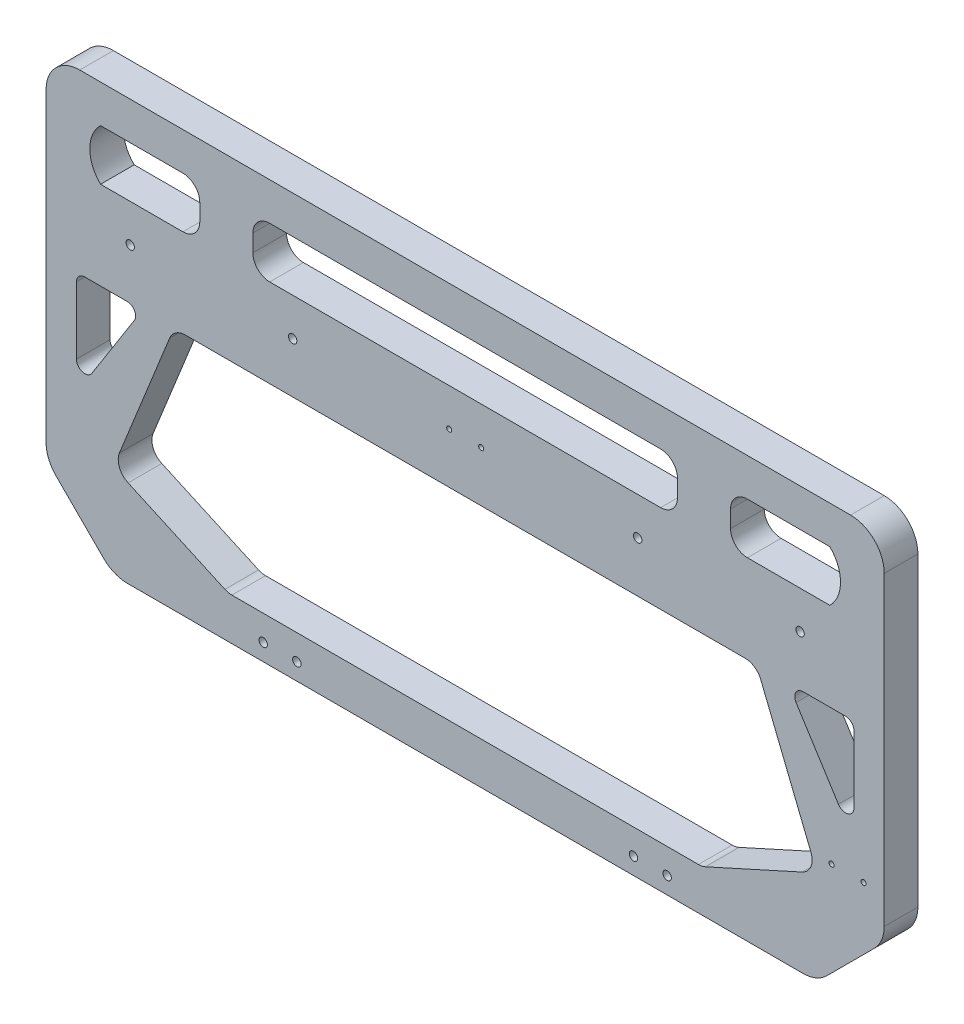
from build123d import *

# Parameters (mm, degrees)
SKETCH1_R           = 2.5
SKETCH1_R_2         = 1.5
BOSS_EXTRUDE1_DEPTH = 20
SKETCH3_R           = 2.5
CUT_EXTRUDE1_DEPTH  = 20
SKETCH4_R           = 1.5
CUT_EXTRUDE2_DEPTH  = 20


with BuildPart() as part:
    # Sketch1 → Boss-Extrude1 (new body)
    with BuildSketch(Plane.XY):
        with BuildLine():
            Line((-200.715728753, -125), (200.715728753, -125))
            ThreePointArc((200.715728753, -125), (208.3693974, -123.47759065), (214.857864376, -119.142135624))
            Line((214.857864376, -119.142135624), (243.142135624, -90.857864376))
            ThreePointArc((243.142135624, -90.857864376), (247.47759065, -84.3693974), (249, -76.715728753))
            Line((249, -76.715728753), (249, 105))
            ThreePointArc((249, 105), (243.142135624, 119.142135624), (229, 125))
            Line((229, 125), (-229, 125))
            ThreePointArc((-229, 125), (-243.142135624, 119.142135624), (-249, 105))
            Line((-249, 105), (-249, -76.715728753))
            ThreePointArc((-249, -76.715728753), (-247.47759065, -84.3693974), (-243.142135624, -90.857864376))
            Line((-243.142135624, -90.857864376), (-214.857864376, -119.142135624))
            ThreePointArc((-214.857864376, -119.142135624), (-208.3693974, -123.47759065), (-200.715728753, -125))
        make_face()
        with Locations((-199, 50)):
            Circle(SKETCH1_R, mode=Mode.SUBTRACT)
        with Locations((-102.5, 50)):
            Circle(SKETCH1_R, mode=Mode.SUBTRACT)
        with Locations(Location((102.5, 50, 0), (0, 0, 180))):
            Circle(SKETCH1_R, mode=Mode.SUBTRACT)
        with Locations(Location((199, 50, 0), (0, 0, 180))):
            Circle(SKETCH1_R, mode=Mode.SUBTRACT)
        with Locations((-9.5, 50)):
            Circle(SKETCH1_R_2, mode=Mode.SUBTRACT)
        with Locations(Location((9.5, 50, 0), (0, 0, 180))):
            Circle(SKETCH1_R_2, mode=Mode.SUBTRACT)
        with BuildLine():
            Line((116.131800265, 102.563522474), (-116.131800265, 102.563522474))
            ThreePointArc((-116.131800265, 102.563522474), (-123.202868077, 99.634590285), (-126.131800265, 92.563522474))
            Line((-126.131800265, 92.563522474), (-126.131800265, 82.389498448))
            ThreePointArc((-126.131800265, 82.389498448), (-123.202868077, 75.318430636), (-116.131800265, 72.389498448))
            Line((-116.131800265, 72.389498448), (116.131800265, 72.389498448))
            ThreePointArc((116.131800265, 72.389498448), (123.202868077, 75.318430636), (126.131800265, 82.389498448))
            Line((126.131800265, 82.389498448), (126.131800265, 92.563522474))
            ThreePointArc((126.131800265, 92.563522474), (123.202868077, 99.634590285), (116.131800265, 102.563522474))
        make_face(mode=Mode.SUBTRACT)
        with BuildLine():
            Line((-216.653872342, 102.563522474), (-167.698471554, 102.563522474))
            ThreePointArc((-167.698471554, 102.563522474), (-160.627403742, 99.634590285), (-157.698471554, 92.563522474))
            Line((-157.698471554, 92.563522474), (-157.698471554, 82.389498448))
            ThreePointArc((-157.698471554, 82.389498448), (-160.627403742, 75.318430636), (-167.698471554, 72.389498448))
            Line((-167.698471554, 72.389498448), (-216.653872342, 72.389498448))
            ThreePointArc((-216.653872342, 72.389498448), (-223.033485264, 87.476510461), (-216.653872342, 102.563522474))
        make_face(mode=Mode.SUBTRACT)
        with BuildLine():
            Line((166.318803771, 20), (-166.318803771, 20))
            ThreePointArc((-166.318803771, 20), (-171.913744739, 18.288343355), (-175.593362129, 13.739327113))
            Line((-175.593362129, 13.739327113), (-205.413984615, -60.224007784))
            ThreePointArc((-205.413984615, -60.224007784), (-205.421516172, -67.683927162), (-200.263522564, -73.073320059))
            Line((-200.263522564, -73.073320059), (-142.749435826, -99.109985162))
            ThreePointArc((-142.749435826, -99.109985162), (-140.734859414, -99.774964236), (-138.625339518, -100))
            Line((-138.625339518, -100), (138.625339518, -100))
            ThreePointArc((138.625339518, -100), (140.734859414, -99.774964236), (142.749435826, -99.109985162))
            Line((142.749435826, -99.109985162), (200.263522564, -73.073320059))
            ThreePointArc((200.263522564, -73.073320059), (205.421516172, -67.683927162), (205.413984615, -60.224007784))
            Line((205.413984615, -60.224007784), (175.593362129, 13.739327113))
            ThreePointArc((175.593362129, 13.739327113), (171.913744739, 18.288343355), (166.318803771, 20))
        make_face(mode=Mode.SUBTRACT)
        with BuildLine():
            Line((-231, 15), (-231, -24.756893222))
            ThreePointArc((-231, -24.756893222), (-227.392475088, -29.55908159), (-221.775594749, -27.431664291))
            Line((-221.775594749, -27.431664291), (-196.602681295, 12.325228931))
            ThreePointArc((-196.602681295, 12.325228931), (-196.446798009, 17.411031382), (-200.827086546, 20))
            Line((-200.827086546, 20), (-226, 20))
            ThreePointArc((-226, 20), (-229.535533906, 18.535533906), (-231, 15))
        make_face(mode=Mode.SUBTRACT)
        with BuildLine():
            Line((221.775594749, -27.431664291), (196.602681295, 12.325228931))
            ThreePointArc((196.602681295, 12.325228931), (196.446798009, 17.411031382), (200.827086546, 20))
            Line((200.827086546, 20), (226, 20))
            ThreePointArc((226, 20), (229.535533906, 18.535533906), (231, 15))
            Line((231, 15), (231, -24.756893222))
            ThreePointArc((231, -24.756893222), (227.392475088, -29.55908159), (221.775594749, -27.431664291))
        make_face(mode=Mode.SUBTRACT)
        with BuildLine():
            Line((157.698471554, 92.563522474), (157.698471554, 82.389498448))
            ThreePointArc((157.698471554, 82.389498448), (160.627403742, 75.318430636), (167.698471554, 72.389498448))
            Line((167.698471554, 72.389498448), (216.653872342, 72.389498448))
            ThreePointArc((216.653872342, 72.389498448), (223.033485264, 87.476510461), (216.653872342, 102.563522474))
            Line((216.653872342, 102.563522474), (167.698471554, 102.563522474))
            ThreePointArc((167.698471554, 102.563522474), (160.627403742, 99.634590285), (157.698471554, 92.563522474))
        make_face(mode=Mode.SUBTRACT)
    extrude(amount=BOSS_EXTRUDE1_DEPTH)

    # Sketch3 → Cut-Extrude1 (cut)
    with BuildSketch(Plane.XY.offset(20)):
        with Locations((-100, -115)):
            Circle(SKETCH3_R)
        with Locations((-120, -115)):
            Circle(SKETCH3_R)
        with Locations(Location((100, -115, 0), (0, 0, 180))):
            Circle(SKETCH3_R)
        with Locations(Location((120, -115, 0), (0, 0, 180))):
            Circle(SKETCH3_R)
    extrude(amount=-CUT_EXTRUDE1_DEPTH, mode=Mode.SUBTRACT)

    # Sketch4 → Cut-Extrude2 (cut)
    with BuildSketch(Plane.XY.offset(20)):
        with Locations((236.706992308, -60.224007784)):
            Circle(SKETCH4_R)
        with Locations((217.706992308, -60.224007784)):
            Circle(SKETCH4_R)
    extrude(amount=-CUT_EXTRUDE2_DEPTH, mode=Mode.SUBTRACT)


solid = part.part
